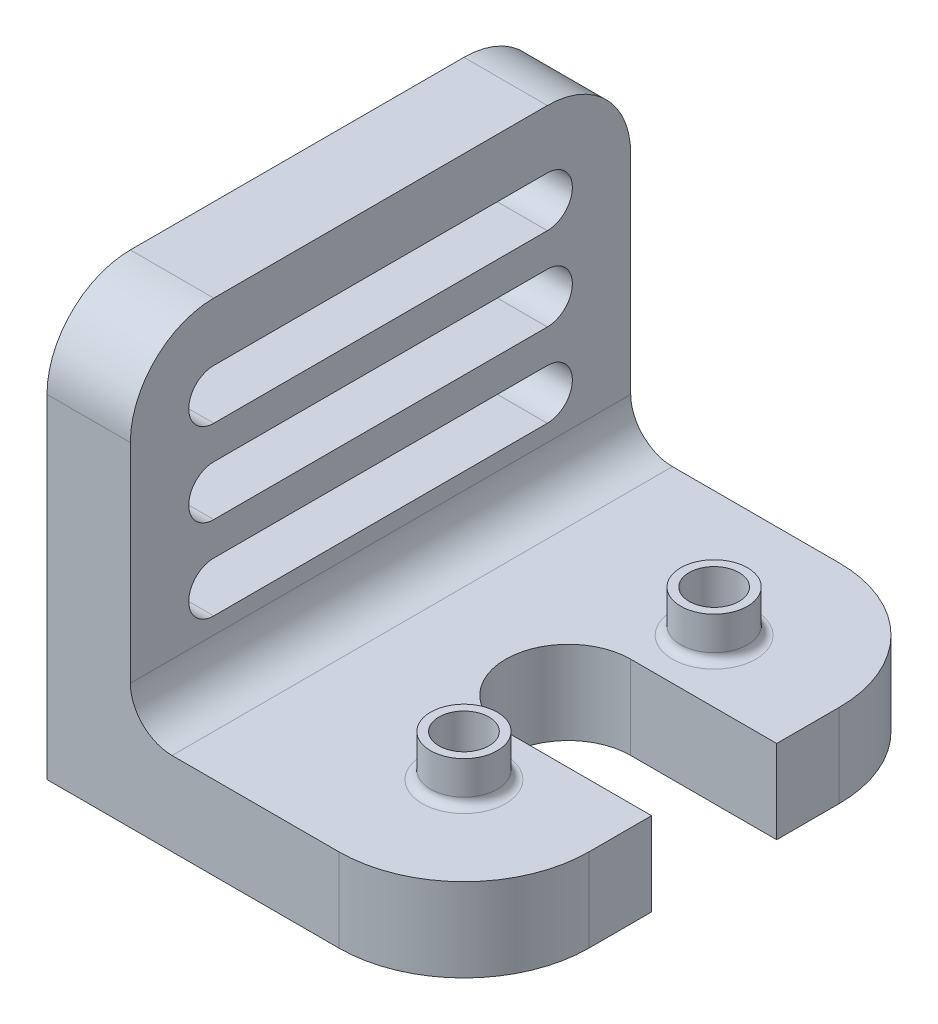
from build123d import *

# Parameters (mm, degrees)
BOSS_EXTRUDE1_DEPTH = 60
FILLET1_R           = 20
FILLET2_R           = 30
FILLET3_R           = 10
CUT_EXTRUDE1_REACH  = 143.421
CUT_EXTRUDE2_REACH  = 143.421
SKETCH3_3_R         = 8
SKETCH3_3_R_2       = 6
BOSS_EXTRUDE2_DEPTH = 10
FILLET4_R           = 2


with BuildPart() as part:
    # Sketch1 → Boss-Extrude1 (new, symmetric)
    with BuildSketch(Plane.XY):
        Polygon((0, 0), (100, 0), (100, 20), (20, 20), (20, 100), (0, 100), align=None)
    extrude(amount=BOSS_EXTRUDE1_DEPTH, both=True)

    # Fillet1
    fillet1_edges = [part.edges().sort_by_distance(p)[0] for p in [
        (10, 100, -60),
        (10, 100, 60),
    ]]
    fillet(fillet1_edges, radius=FILLET1_R)

    # Fillet2
    fillet2_edges = [part.edges().sort_by_distance(p)[0] for p in [
        (100, 10, -60),
        (100, 10, 60),
    ]]
    fillet(fillet2_edges, radius=FILLET2_R)

    # Fillet3
    fillet3_edges = [part.edges().sort_by_distance(p)[0] for p in [
        (20, 20, 0),
    ]]
    fillet(fillet3_edges, radius=FILLET3_R)

    # Sketch2 → Cut-Extrude1 (cut, up to next)
    with BuildSketch(Plane(origin=(20, 0, 0), x_dir=(0, 0, -1), z_dir=(1, 0, 0)), mode=Mode.PRIVATE) as cut_extrude1_sk1:
        with BuildLine():
            Line((-40, 86), (40, 86))
            ThreePointArc((40, 86), (46, 80), (40, 74))
            Line((40, 74), (-40, 74))
            ThreePointArc((-40, 74), (-46, 80), (-40, 86))
        make_face()
    cut_extrude1_tool1 = extrude(cut_extrude1_sk1.sketch, amount=-CUT_EXTRUDE1_REACH, mode=Mode.PRIVATE) & part.part
    # Sketch2 → Cut-Extrude1 (cut, up to next)
    with BuildSketch(Plane(origin=(20, 0, 0), x_dir=(0, 0, -1), z_dir=(1, 0, 0)), mode=Mode.PRIVATE) as cut_extrude1_sk2:
        with BuildLine():
            Line((-40, 66), (40, 66))
            ThreePointArc((40, 66), (46, 60), (40, 54))
            Line((40, 54), (-40, 54))
            ThreePointArc((-40, 54), (-46, 60), (-40, 66))
        make_face()
    cut_extrude1_tool2 = extrude(cut_extrude1_sk2.sketch, amount=-CUT_EXTRUDE1_REACH, mode=Mode.PRIVATE) & part.part
    # Sketch2 → Cut-Extrude1 (cut, up to next)
    with BuildSketch(Plane(origin=(20, 0, 0), x_dir=(0, 0, -1), z_dir=(1, 0, 0)), mode=Mode.PRIVATE) as cut_extrude1_sk3:
        with BuildLine():
            Line((-40, 46), (40, 46))
            ThreePointArc((40, 46), (46, 40), (40, 34))
            Line((40, 34), (-40, 34))
            ThreePointArc((-40, 34), (-46, 40), (-40, 46))
        make_face()
    cut_extrude1_tool3 = extrude(cut_extrude1_sk3.sketch, amount=-CUT_EXTRUDE1_REACH, mode=Mode.PRIVATE) & part.part
    add(cut_extrude1_tool1.solids().sort_by_distance((20, 80, 0))[0], mode=Mode.SUBTRACT)
    add(cut_extrude1_tool2.solids().sort_by_distance((20, 60, 0))[0], mode=Mode.SUBTRACT)
    add(cut_extrude1_tool3.solids().sort_by_distance((20, 40, 0))[0], mode=Mode.SUBTRACT)

    # Sketch3 → Cut-Extrude2 (cut, up to next)
    with BuildSketch(Plane(origin=(0, 20, 0), x_dir=(1, 0, 0), z_dir=(0, 1, 0)), mode=Mode.PRIVATE) as cut_extrude2_sk1:
        with BuildLine():
            Line((65, -15), (100, -15))
            Line((100, -15), (100, 15))
            Line((100, 15), (65, 15))
            ThreePointArc((65, 15), (50, 0), (65, -15))
        make_face()
    cut_extrude2_tool1 = extrude(cut_extrude2_sk1.sketch, amount=-CUT_EXTRUDE2_REACH, mode=Mode.PRIVATE) & part.part
    add(cut_extrude2_tool1.solids().sort_by_distance((76.489714, 20, 0))[0], mode=Mode.SUBTRACT)

    # Sketch3<3> → Boss-Extrude2 (add)
    # profile 1 of 2: a face of its own
    with BuildSketch(Plane(origin=(0, 20, 0), x_dir=(1, 0, 0), z_dir=(0, 1, 0))):
        with Locations((70, 30)):
            Circle(SKETCH3_3_R)
        with Locations((70, 30)):
            Circle(SKETCH3_3_R_2, mode=Mode.SUBTRACT)
    # profile 2 of 2: a face of its own
    with BuildSketch(Plane(origin=(0, 20, 0), x_dir=(1, 0, 0), z_dir=(0, 1, 0))):
        with Locations((70, -30)):
            Circle(SKETCH3_3_R)
        with Locations((70, -30)):
            Circle(SKETCH3_3_R_2, mode=Mode.SUBTRACT)
    extrude(amount=BOSS_EXTRUDE2_DEPTH)

    # Fillet4
    fillet4_edges = [part.edges().sort_by_distance(p)[0] for p in [
        (62, 20, 30),
        (62, 20, -30),
    ]]
    fillet(fillet4_edges, radius=FILLET4_R)


solid = part.part
